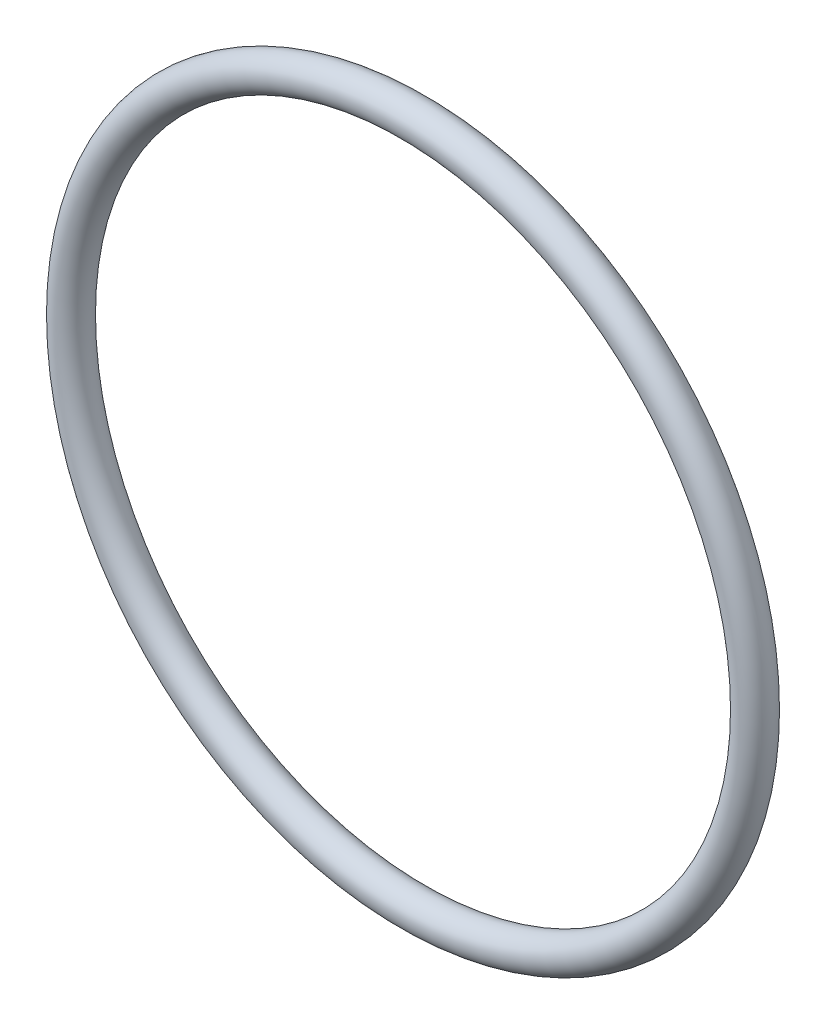
from build123d import *

# Parameters (mm, degrees)
SKETCH2_R = 0.75


with BuildPart() as part:
    # Sketch2 → Revolve1 (revolve)
    with BuildSketch(Plane(origin=(0, 0, 0), x_dir=(1, 0, 0), z_dir=(0, 1, 0))):
        with Locations((14.8, 0)):
            Circle(SKETCH2_R)
    revolve(axis=Axis((0, 0, -0.75), (0, 0, 1)))


solid = part.part
